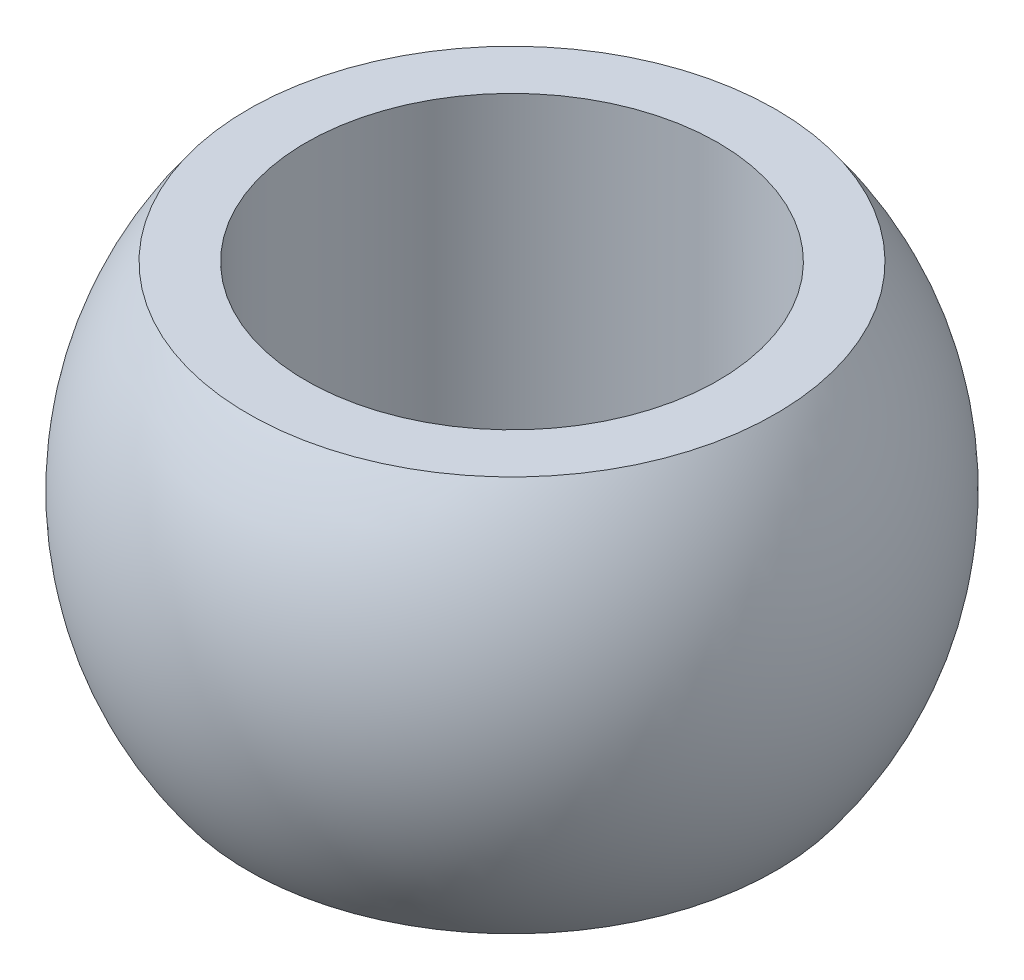
from build123d import *

# Parameters (mm, degrees)
SKETCH2_R          = 3.125
CUT_EXTRUDE1_DEPTH = 10.273618495


with BuildPart() as part:
    # Sketch1 → Revolve1 (revolve)
    with BuildSketch(Plane(origin=(0, 0, 0), x_dir=(0, 0, -1), z_dir=(1, 0, 0))):
        with BuildLine():
            Line((0, 3), (0, -3))
            Line((0, -3), (4, -3))
            ThreePointArc((4, -3), (5, 0), (4, 3))
            Line((4, 3), (0, 3))
        make_face()
    revolve(axis=Axis((0, 3, 0), (0, -1, 0)))

    # Sketch2 → Cut-Extrude1 (cut, through all)
    with BuildSketch(Plane.XZ.offset(3)):
        with Locations(Location((0, 0, 0), (0, 0, 270))):
            Circle(SKETCH2_R)
    extrude(amount=-CUT_EXTRUDE1_DEPTH, mode=Mode.SUBTRACT)


solid = part.part
